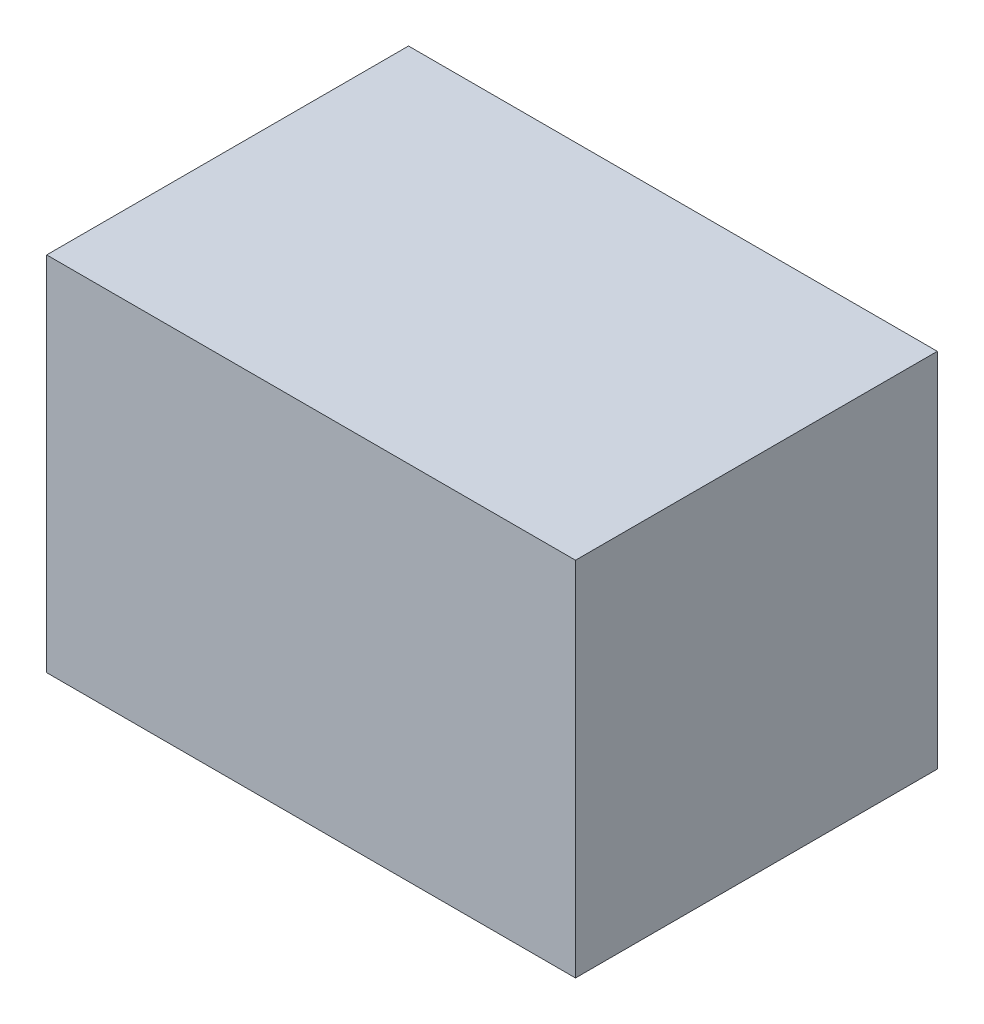
from build123d import *

# Parameters (mm, degrees)
SKIZZE1_W                       = 95
SKIZZE1_H                       = 65
AUFSATZ_LINEAR_AUSTRAGEN1_DEPTH = 65


with BuildPart() as part:
    # Skizze1 → Aufsatz-Linear austragen1 (new body)
    with BuildSketch(Plane.XY):
        Rectangle(SKIZZE1_W, SKIZZE1_H)
    extrude(amount=AUFSATZ_LINEAR_AUSTRAGEN1_DEPTH)


solid = part.part
